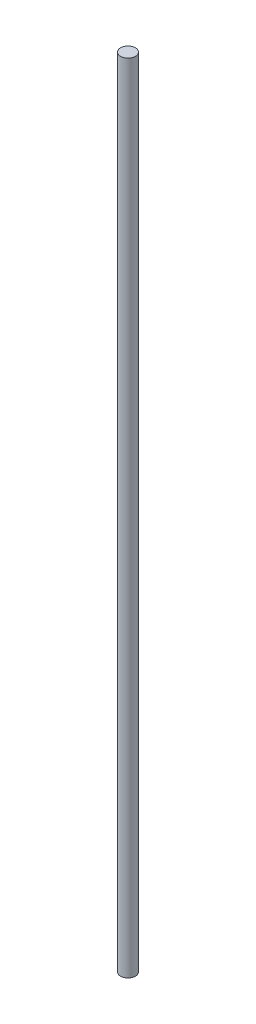
from build123d import *

# Parameters (mm, degrees)
SKETCH1_R           = 4
BOSS_EXTRUDE1_DEPTH = 215


with BuildPart() as part:
    # Sketch1 → Boss-Extrude1 (new, symmetric)
    with BuildSketch(Plane(origin=(0, 0, 0), x_dir=(1, 0, 0), z_dir=(0, 1, 0))):
        with Locations(Location((0, 0, 0), (0, 0, 270))):
            Circle(SKETCH1_R)
    extrude(amount=BOSS_EXTRUDE1_DEPTH, both=True)


solid = part.part
